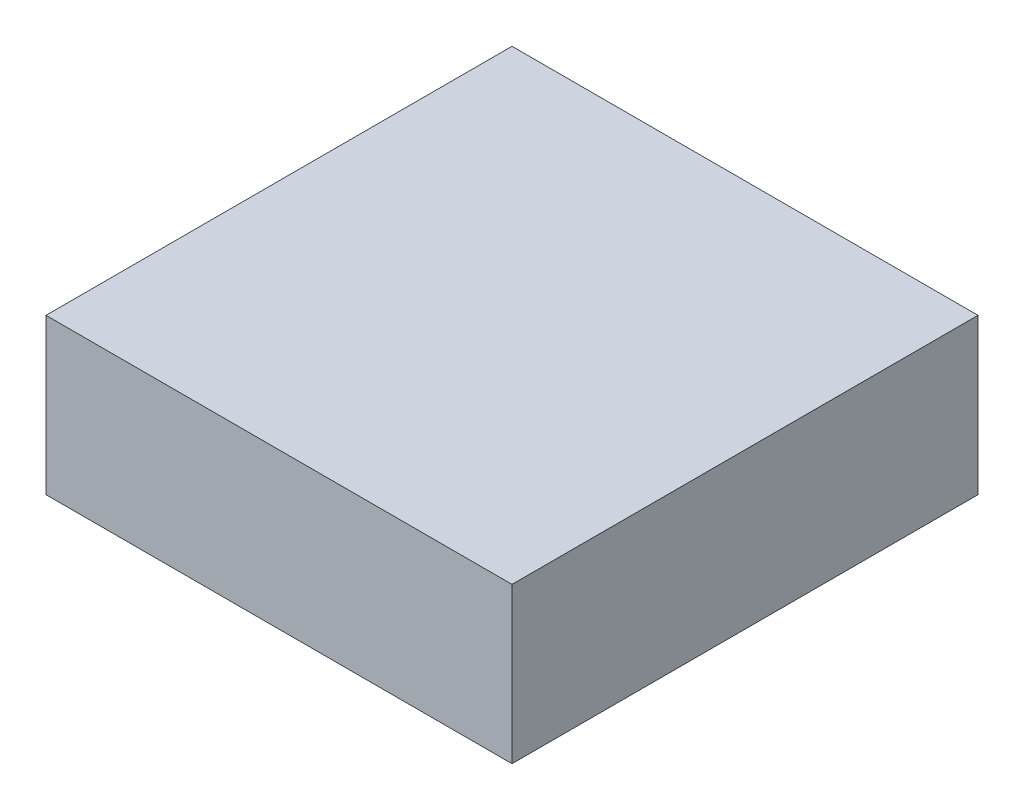
from build123d import *

# Parameters (mm, degrees)
SKETCH1_W           = 152.4
SKETCH1_H           = 50.8
BOSS_EXTRUDE1_DEPTH = 76.2


with BuildPart() as part:
    # Sketch1 → Boss-Extrude1 (new, symmetric)
    with BuildSketch(Plane(origin=(0, 0, 0), x_dir=(0, 0, -1), z_dir=(1, 0, 0))):
        Rectangle(SKETCH1_W, SKETCH1_H)
    extrude(amount=BOSS_EXTRUDE1_DEPTH, both=True)


solid = part.part
